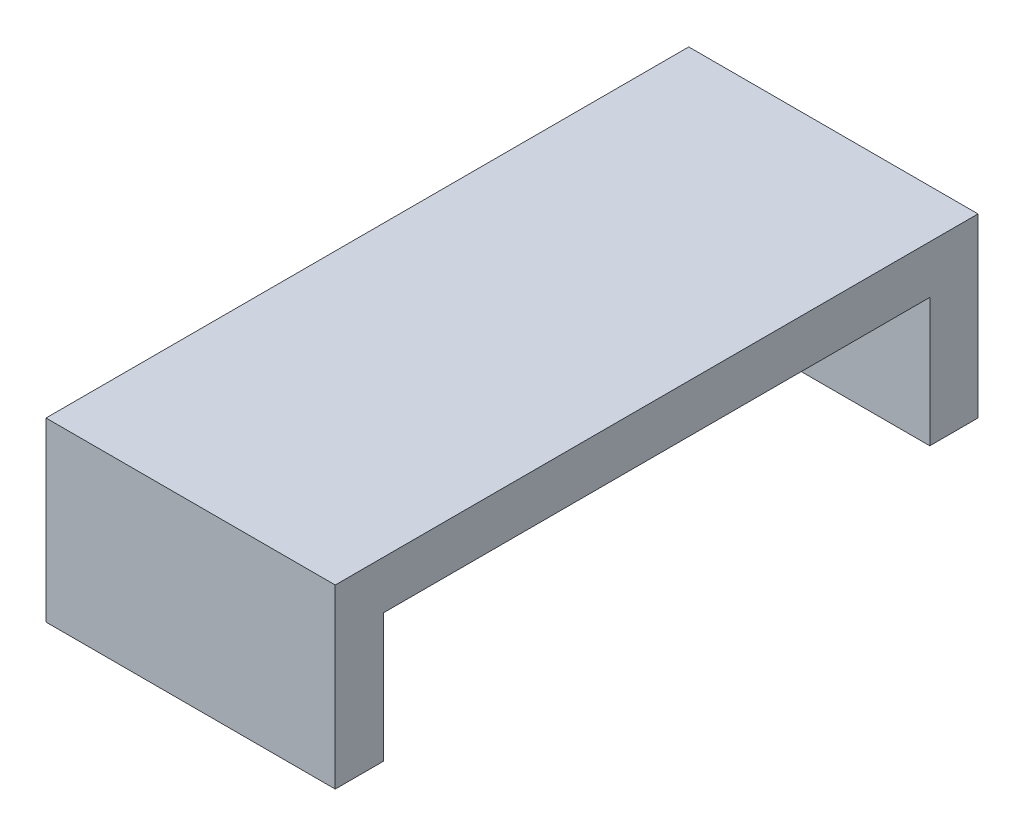
from build123d import *

# Parameters (mm, degrees)
BOSS_EXTRU_1_DEPTH = 150
ESQUISSE2_W        = 400
ESQUISSE2_H        = 110
BOSS_EXTRU_2_DEPTH = 30


with BuildPart() as part:
    # Esquisse1 → Boss.-Extru.1 (new body)
    with BuildSketch(Plane(origin=(0, 0, 0), x_dir=(0, 0, -1), z_dir=(1, 0, 0))):
        Polygon((0, 80), (0, 0), (30, 0), (30, 110), (-370, 110), (-370, 0), (-340, 0), (-340, 80), align=None)
    extrude(amount=BOSS_EXTRU_1_DEPTH)

    # Esquisse2 → Boss.-Extru.2 (add)
    with BuildSketch(Plane.ZY):
        with Locations((170, 55)):
            Rectangle(ESQUISSE2_W, ESQUISSE2_H)
    extrude(amount=BOSS_EXTRU_2_DEPTH)


solid = part.part
